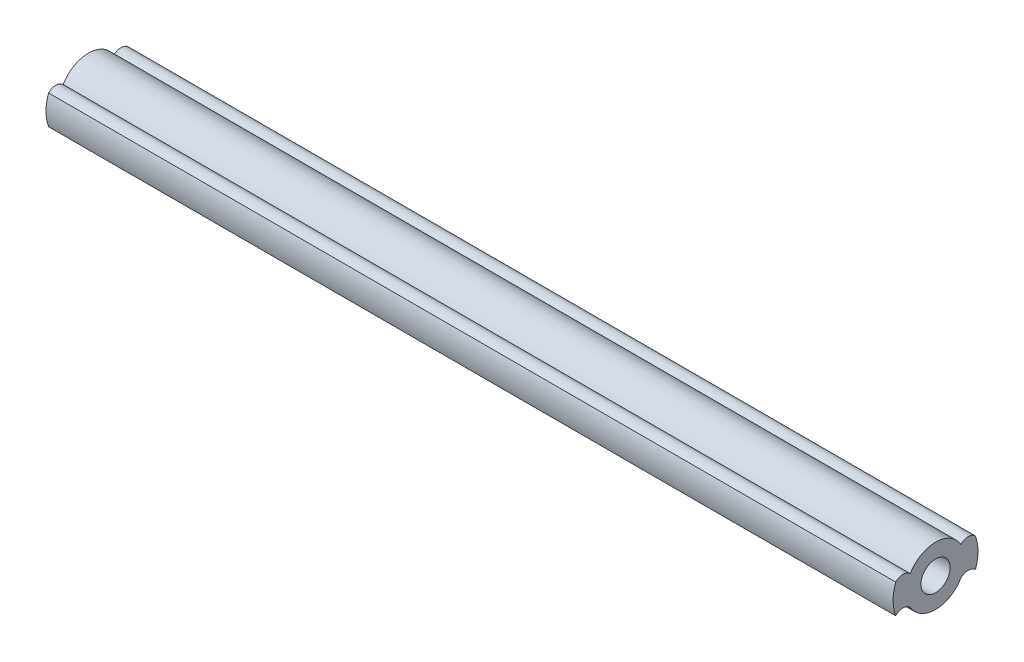
from build123d import *

# Parameters (mm, degrees)
SKETCH1_R           = 10
SKETCH1_R_2         = 5
BOSS_EXTRUDE1_DEPTH = 290


with BuildPart() as part:
    # Sketch1 → Boss-Extrude1 (new body)
    # profile 1 of 3: a face of its own
    with BuildSketch(Plane(origin=(0, 0, 0), x_dir=(0, 0, -1), z_dir=(1, 0, 0))):
        Circle(SKETCH1_R)
        Circle(SKETCH1_R_2, mode=Mode.SUBTRACT)
    # profile 2 of 3: a face of its own
    with BuildSketch(Plane(origin=(0, 0, 0), x_dir=(0, 0, -1), z_dir=(1, 0, 0))):
        with BuildLine():
            ThreePointArc((8.656235338, 5.006954141), (9.658218091, 2.59206931), (10, 0))
            ThreePointArc((10, 0), (9.657587422, -2.594418084), (8.653798961, -5.011163891))
            ThreePointArc((8.653798961, -5.011163891), (11.157678989, -3.972789688), (13.662430885, -5.009059016))
            ThreePointArc((13.662430885, -5.009059016), (14.533959389, -0.004529508), (13.662430885, 5))
            ThreePointArc((13.662430885, 5), (11.160773363, 6.040295531), (8.656235338, 5.006954141))
        make_face()
    # profile 3 of 3: a face of its own
    with BuildSketch(Plane(origin=(0, 0, 0), x_dir=(0, 0, -1), z_dir=(1, 0, 0))):
        with BuildLine():
            ThreePointArc((-8.653798961, -5.011163891), (-9.999999704, -0.002431971), (-8.656235338, 5.006954141))
            ThreePointArc((-8.656235338, 5.006954141), (-11.160773363, 6.040295531), (-13.662430885, 5))
            ThreePointArc((-13.662430885, 5), (-14.533959389, -0.004529508), (-13.662430885, -5.009059016))
            ThreePointArc((-13.662430885, -5.009059016), (-11.157678989, -3.972789688), (-8.653798961, -5.011163891))
        make_face()
    extrude(amount=BOSS_EXTRUDE1_DEPTH)


solid = part.part
